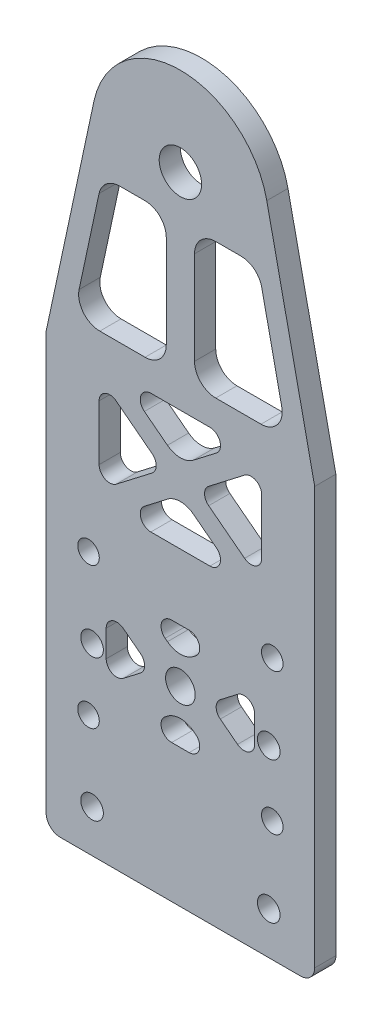
from build123d import *

# Parameters (mm, degrees)
SKETCH_1_R           = 3
EXTRUDE_1_DEPTH      = 3
SKETCH_2_R           = 1.600000000000003
EXTRUDE_2_DEPTH      = 3
SKETCH_13_R          = 1.5250000000000004
CUT_EXTRUDE_8_DEPTH  = 10
CUT_EXTRUDE_9_DEPTH  = 10
CUT_EXTRUDE_10_DEPTH = 10
FILLET_7_R           = 3
FILLET_8_R           = 1.5
SKETCH_18_R          = 2.0999999999999996
CUT_EXTRUDE_11_DEPTH = 3
FILLET_2_R           = 2
SKETCH_12_R          = 1.600000000000003
CUT_EXTRUDE_7_DEPTH  = 10


with BuildPart() as part:
    # 草图1 → 凸台-拉伸1 (new body)
    with BuildSketch(Plane.XY):
        with BuildLine():
            Line((-18.999999999999996, -40), (19.000000000000004, -39.99999999999999))
            Line((19.000000000000004, -39.99999999999999), (19.000000000000004, -28.999999999999993))
            Line((19.000000000000004, -28.999999999999993), (12.222376083061231, 2.619832606143564))
            ThreePointArc((12.222376083061231, 2.619832606143564), (-2.01e-15, 12.500000000000007), (-12.222376083061231, 2.619832606143561))
            Line((-12.222376083061231, 2.619832606143561), (-18.999999999999996, -28.999999999999996))
            Line((-18.999999999999996, -28.999999999999996), (-18.999999999999996, -40))
        make_face()
        Circle(SKETCH_1_R, mode=Mode.SUBTRACT)
    extrude(amount=EXTRUDE_1_DEPTH)

    # 草图2 → 凸台-拉伸2 (add)
    with BuildSketch(Plane.XY.offset(3)):
        Polygon((-18.999999999999996, -40), (19.000000000000004, -39.99999999999999), (19.00000000000001, -90), (-18.99999999999999, -90), align=None)
        with Locations((-12.499999999999991, -83.99999999999999)):
            Circle(SKETCH_2_R, mode=Mode.SUBTRACT)
        with Locations((12.50000000000001, -83.99999999999999)):
            Circle(SKETCH_2_R, mode=Mode.SUBTRACT)
    extrude(amount=-EXTRUDE_2_DEPTH)

    # 草图13 → 切除-拉伸8 (cut)
    with BuildSketch(Plane.XY.offset(3)):
        with Locations((-12.999999999999984, -52.99999999999999)):
            Circle(SKETCH_13_R)
        with Locations((-12.999999999999982, -73)):
            Circle(SKETCH_13_R)
        with Locations((13.000000000000014, -52.99999999999999)):
            Circle(SKETCH_13_R)
        with Locations((13.000000000000016, -73)):
            Circle(SKETCH_13_R)
    extrude(amount=-CUT_EXTRUDE_8_DEPTH, mode=Mode.SUBTRACT)

    # 草图14 → 切除-拉伸9 (cut)
    with BuildSketch(Plane.XY.offset(3)):
        Polygon((-5.649695133285826, -55.49999999999999), (1.066e-14, -59.84591933329679), (1.375e-14, -55.49999999999999), align=None)
        Polygon((1.375e-14, -55.49999999999999), (1.483e-14, -59.845919333296784), (5.649695133285826, -55.49999999999999), align=None)
        Polygon((-10.499999999999963, -58.07715758978017), (-10.499999999999963, -67.92284241021984), (-4.100304866714181, -63.00000000000001), align=None)
        Polygon((-3.55e-15, -66.15408066670322), (-5.649695133285805, -70.5), (5.64969513328581, -70.5), align=None)
        Polygon((10.500000000000018, -58.077157589780114), (4.100304866714181, -63), (10.500000000000021, -67.92284241021987), align=None)
        Polygon((9.81e-15, -39.569701478766), (1.144e-14, -46.176084263737856), (8.588297620463438, -46.176084263737856), align=None)
        Polygon((-8.591336539479556, -46.176084263737856), (1.066e-14, -46.176084263737856), (9.81e-15, -39.569701478766), (-0.00151945950806542, -39.56853266375978), align=None)
        Polygon((-11.501519459508062, -30.722378817605943), (-11.501519459508062, -44.62978970986978), (-2.4617023795365665, -37.676084263737856), align=None)
        Polygon((-8.591336539479554, -29.176084263737856), (-0.00151945950806187, -35.78363586371593), (8.88e-15, -35.78246704870972), (7.23e-15, -29.176084263737856), align=None)
        Polygon((7.23e-15, -29.176084263737856), (8.87e-15, -35.78246704870972), (8.588297620463424, -29.176084263737856), align=None)
        Polygon((2.45866346052045, -37.67608426373786), (11.498480540491945, -44.62978970986978), (11.498480540491938, -30.72237881760594), align=None)
    extrude(amount=-CUT_EXTRUDE_9_DEPTH, mode=Mode.SUBTRACT)

    # 草图16 → 切除-拉伸10 (cut)
    with BuildSketch(Plane.XY.offset(3)):
        Polygon((-11.001870235626251, -6.000000000000001), (-15.112211013138483, -25.176084263737856), (-1.9999999999999978, -25.176084263737852), (-2, -6), align=None)
        Polygon((15.112211013138486, -25.17608426373785), (2.000000000000002, -25.176084263737856), (2, -5.999999999999999), (11.001870235626251, -5.999999999999998), align=None)
    extrude(amount=-CUT_EXTRUDE_10_DEPTH, mode=Mode.SUBTRACT)

    # 圆角7
    fillet_7_edges = [part.edges().sort_by_distance(p)[0] for p in [
        (-2.66e-15, -66.15408066670322, 1.5),
        (-0.00151945950806276, -35.78363586371593, 1.5),
        (1.274e-14, -59.84591933329679, 1.5),
        (-15.112211013138483, -25.176084263737856, 1.5),
        (-11.001870235626251, -6.000000000000001, 1.5),
        (-2, -6, 1.5),
        (-1.9999999999999978, -25.176084263737852, 1.5),
        (15.112211013138486, -25.17608426373785, 1.5),
        (2.000000000000002, -25.176084263737856, 1.5),
        (2, -5.999999999999999, 1.5),
        (11.001870235626251, -5.999999999999998, 1.5),
        (-0.00151945950806276, -39.56853266375978, 1.5),
    ]]
    fillet(fillet_7_edges, radius=FILLET_7_R)

    # 圆角8
    fillet_8_edges = [part.edges().sort_by_distance(p)[0] for p in [
        (4.1003048667141835, -63, 1.5),
        (10.500000000000016, -58.077157589780114, 1.5),
        (10.500000000000018, -67.92284241021987, 1.5),
        (-10.499999999999963, -67.92284241021984, 1.5),
        (-10.499999999999963, -58.07715758978017, 1.5),
        (-4.10030486671418, -63.00000000000001, 1.5),
        (-5.649695133285805, -70.5, 1.5),
        (5.64969513328581, -70.5, 1.5),
        (2.4586634605204445, -37.67608426373786, 1.5),
        (11.498480540491936, -30.722378817605943, 1.5),
        (11.498480540491942, -44.62978970986978, 1.5),
        (-11.501519459508062, -44.62978970986978, 1.5),
        (-11.501519459508062, -30.722378817605943, 1.5),
        (-2.4617023795365665, -37.676084263737856, 1.5),
        (8.588297620463425, -29.176084263737856, 1.5),
        (-8.591336539479554, -29.176084263737856, 1.5),
        (-5.649695133285826, -55.49999999999999, 1.5),
        (5.649695133285826, -55.49999999999999, 1.5),
        (8.588297620463436, -46.17608426373785, 1.5),
        (-8.591336539479556, -46.176084263737856, 1.5),
    ]]
    fillet(fillet_8_edges, radius=FILLET_8_R)

    # 草图18 → 切除-拉伸11 (cut)
    with BuildSketch(Plane(origin=(0, 0, 0), x_dir=(-1, 0, 0), z_dir=(0, 0, -1))):
        with Locations((-1.561e-14, -63)):
            Circle(SKETCH_18_R)
    extrude(amount=-CUT_EXTRUDE_11_DEPTH, mode=Mode.SUBTRACT)

    # 圆角2
    fillet_2_edges = [part.edges().sort_by_distance(p)[0] for p in [
        (-18.99999999999999, -90, 1.5),
        (19.00000000000001, -90, 1.5),
    ]]
    fillet(fillet_2_edges, radius=FILLET_2_R)

    # 草图12 → 切除-拉伸7 (cut)
    with BuildSketch(Plane.XY.offset(3)):
        with Locations((-12.499999999999991, -63.999999999999986)):
            Circle(SKETCH_12_R)
        with Locations((12.50000000000001, -63.999999999999986)):
            Circle(SKETCH_12_R)
    extrude(amount=-CUT_EXTRUDE_7_DEPTH, mode=Mode.SUBTRACT)


solid = part.part
